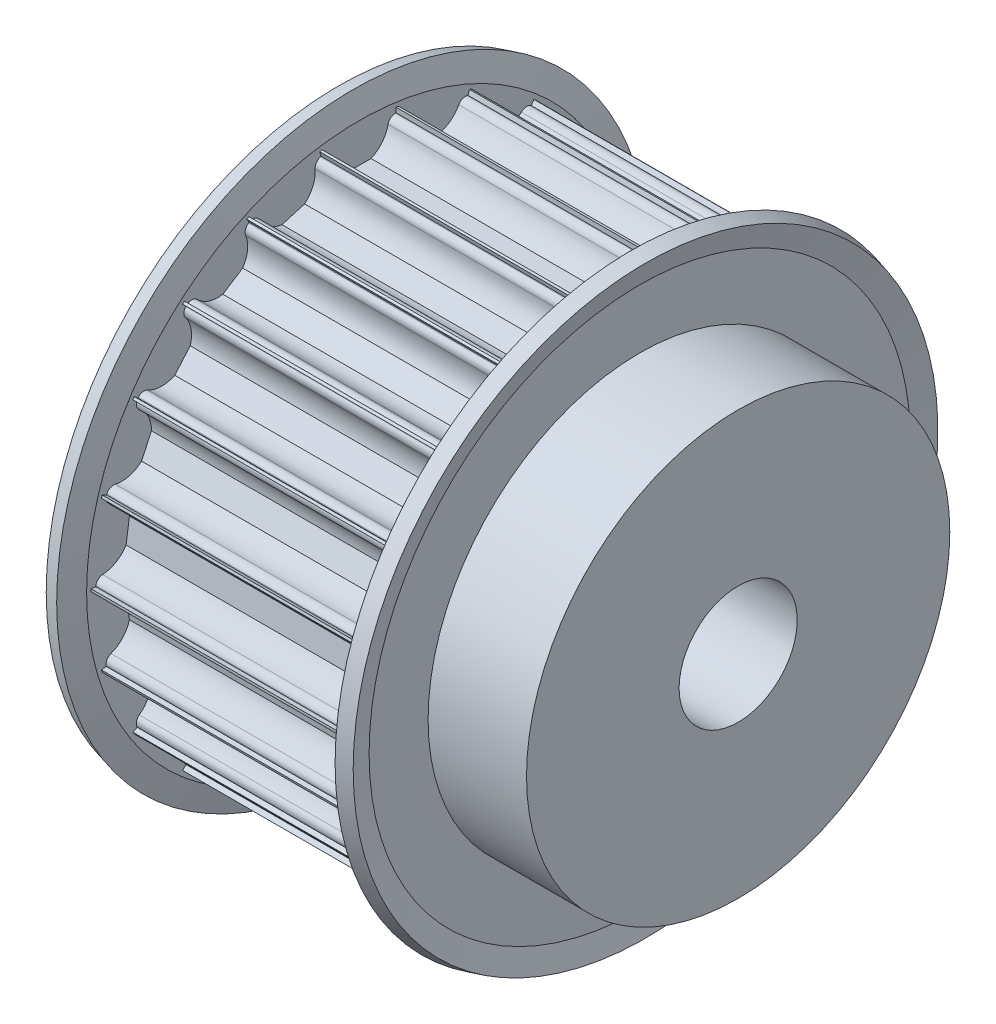
from build123d import *

# Parameters (mm, degrees)
CUT_EXTRUDE1_DEPTH = 56.543901555
CIRPATTERN1_COUNT  = 22


with BuildPart() as part:
    # Sketch1 → Revolve1 (revolve)
    with BuildSketch(Plane.XY, mode=Mode.PRIVATE) as revolve1_sk:
        Polygon((0, 6), (0, 27.25), (30, 27.25), (30, 21.5), (40, 21.5), (40, 6), align=None)
    revolve(revolve1_sk.sketch.rotate(Axis((0, 0, 0), (1, 0, 0)), 90), axis=Axis((0, 0, 0), (1, 0, 0)))

    # Sketch2 → Cut-Extrude1 (cut, through all)
    with BuildSketch(Plane.ZY):
        with BuildLine():
            Line((-3.674234614, 26.5), (-3.75, 26.5))
            Line((-3.75, 26.5), (-3.75, 28.5))
            Line((-3.75, 28.5), (3.75, 28.5))
            Line((3.75, 28.5), (3.75, 26.5))
            Line((3.75, 26.5), (3.674234614, 26.5))
            ThreePointArc((3.674234614, 26.5), (3.199892965, 26.330947502), (2.939387691, 25.9))
            ThreePointArc((2.939387691, 25.9), (2.331759211, 24.612435701), (1.198957881, 23.75))
            Line((1.198957881, 23.75), (-1.198957881, 23.75))
            ThreePointArc((-1.198957881, 23.75), (-2.331759211, 24.612435701), (-2.939387691, 25.9))
            ThreePointArc((-2.939387691, 25.9), (-3.199892965, 26.330947502), (-3.674234614, 26.5))
        make_face()
    cut_extrude1 = extrude(amount=-CUT_EXTRUDE1_DEPTH, mode=Mode.SUBTRACT)

    # CirPattern1: Cut-Extrude1 ×22 about axis
    cirpattern1_axis = Axis((0, 0, 0), (1, 0, 0))
    for i in range(1, CIRPATTERN1_COUNT):
        add(cut_extrude1.rotate(cirpattern1_axis, i * 360 / CIRPATTERN1_COUNT), mode=Mode.SUBTRACT)

    # Sketch3 → Revolve2 (revolve)
    with BuildSketch(Plane.XY, mode=Mode.PRIVATE) as revolve2_sk:
        Polygon((30, 21.5), (28.5, 21.5), (28.5, 27.69), (29.143078062, 30.09), (30.591966801, 29.701771432), (30, 27.492521254), align=None)
        Polygon((0, 21.5), (1.5, 21.5), (1.5, 27.69), (0.856921938, 30.09), (-0.591966801, 29.701771432), (0, 27.492521254), align=None)
    revolve(revolve2_sk.sketch.rotate(Axis((0, 0, 0), (1, 0, 0)), 90), axis=Axis((0, 0, 0), (1, 0, 0)))


solid = part.part
